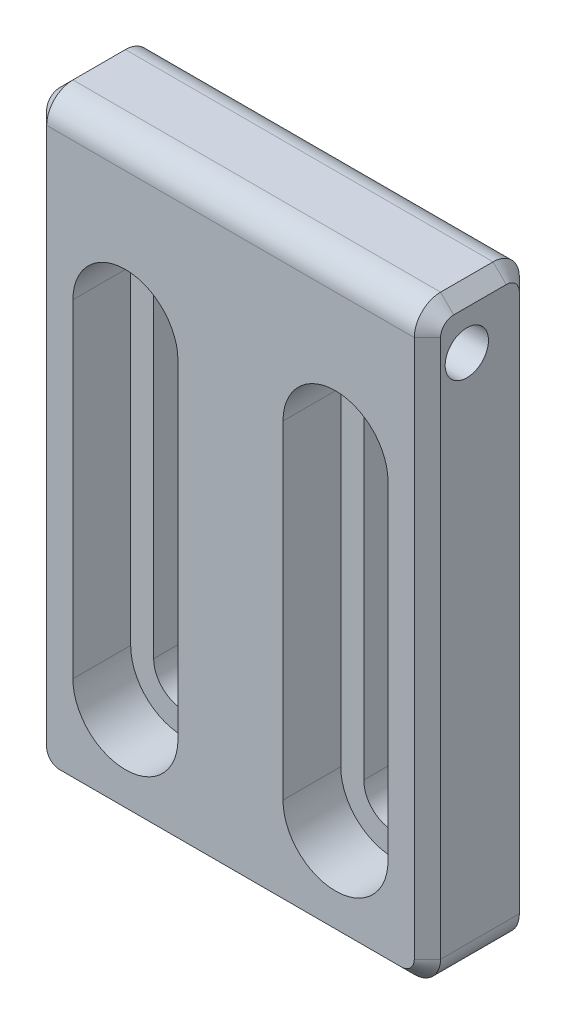
from build123d import *

# Parameters (mm, degrees)
SKETCH1_W           = 30
SKETCH1_H           = 75
BOSS_EXTRUDE1_DEPTH = 8
FILLET2_R           = 2
CUT_EXTRUDE3_DEPTH  = 4.4
CUT_EXTRUDE4_DEPTH  = 4.4
SKETCH11_W          = 30
SKETCH11_H          = 30
CUT_EXTRUDE5_DEPTH  = 29.4
FILLET3_R           = 2
CHAMFER1_SIZE       = 1


with BuildPart() as part:
    # Sketch1 → Boss-Extrude1 (new body)
    with BuildSketch(Plane.XY):
        Rectangle(SKETCH1_W, SKETCH1_H)
    extrude(amount=BOSS_EXTRUDE1_DEPTH)

    # Sketch3 → M4 Tapped Hole1 (revolve, cut)
    with BuildSketch(Plane(origin=(15, 33.5, 5), x_dir=(0, 0, -1), z_dir=(0, 1, 0))):
        Polygon((0, 0), (0, 12.491420021), (1.65, 11.5), (1.65, 0), align=None)
    m4_tapped_hole1 = revolve(axis=Axis((21.35, 33.5, 5), (-1, 0, 0)), mode=Mode.SUBTRACT)

    # Fillet2
    fillet2_edges = [part.edges().sort_by_distance(p)[0] for p in [
        (0, 37.5, 0),
        (0, 37.5, 8),
    ]]
    fillet(fillet2_edges, radius=FILLET2_R)

    # Sketch9 → Cut-Extrude3 (cut)
    with BuildSketch(Plane.XY.offset(8)):
        with BuildLine():
            Line((-12, 0), (-12, 25))
            ThreePointArc((-12, 25), (-8, 29), (-4, 25))
            Line((-4, 25), (-4, 0))
            ThreePointArc((-4, 0), (-8, -4), (-12, 0))
        make_face()
        with BuildLine():
            Line((12, 0), (12, 25))
            ThreePointArc((12, 25), (8, 29), (4, 25))
            Line((4, 25), (4, 0))
            ThreePointArc((4, 0), (8, -4), (12, 0))
        make_face()
    extrude(amount=-CUT_EXTRUDE3_DEPTH, mode=Mode.SUBTRACT)

    # Sketch10 → Cut-Extrude4 (cut)
    with BuildSketch(Plane.XY.offset(3.6)):
        with BuildLine():
            Line((-5.75, 25), (-5.75, 0))
            ThreePointArc((-5.75, 0), (-8, -2.25), (-10.25, 0))
            Line((-10.25, 0), (-10.25, 25))
            ThreePointArc((-10.25, 25), (-8, 27.25), (-5.75, 25))
        make_face()
        with BuildLine():
            Line((5.75, 25), (5.75, 0))
            ThreePointArc((5.75, 0), (8, -2.25), (10.25, 0))
            Line((10.25, 0), (10.25, 25))
            ThreePointArc((10.25, 25), (8, 27.25), (5.75, 25))
        make_face()
    extrude(amount=-CUT_EXTRUDE4_DEPTH, mode=Mode.SUBTRACT)

    # Sketch11 → Cut-Extrude5 (cut)
    with BuildSketch(Plane.XY.offset(8)):
        with Locations((0, -22.5)):
            Rectangle(SKETCH11_W, SKETCH11_H)
    extrude(amount=-CUT_EXTRUDE5_DEPTH, mode=Mode.SUBTRACT)

    # Fillet3
    fillet3_edges = [part.edges().sort_by_distance(p)[0] for p in [
        (15, -7.5, 4),
        (-15, -7.5, 4),
    ]]
    fillet(fillet3_edges, radius=FILLET3_R)

    # Mirror1: M4 Tapped Hole1 across plane
    add(m4_tapped_hole1.mirror(Plane(origin=(0, 0, 0), x_dir=(0, 0, 1), z_dir=(1, 0, 0))), mode=Mode.SUBTRACT)

    # Chamfer1
    chamfer1_edges = [part.edges().sort_by_distance(p)[0] for p in [
        (0, -7.5, 8),
        (0, -7.5, 0),
        (15, 15, 8),
        (-14.414213562, -6.914213562, 8),
        (14.414213562, -6.914213562, 8),
        (15, 15, 0),
        (-14.414213562, -6.914213562, 0),
        (14.414213562, -6.914213562, 0),
        (-15, 37.5, 4),
        (15, 37.5, 4),
        (-15, 15, 0),
        (-15, 15, 8),
        (-15, 36.914213562, 7.414213562),
        (-15, 36.914213562, 0.585786438),
        (15, 36.914213562, 7.414213562),
        (15, 36.914213562, 0.585786438),
    ]]
    chamfer(chamfer1_edges, length=CHAMFER1_SIZE)


solid = part.part
